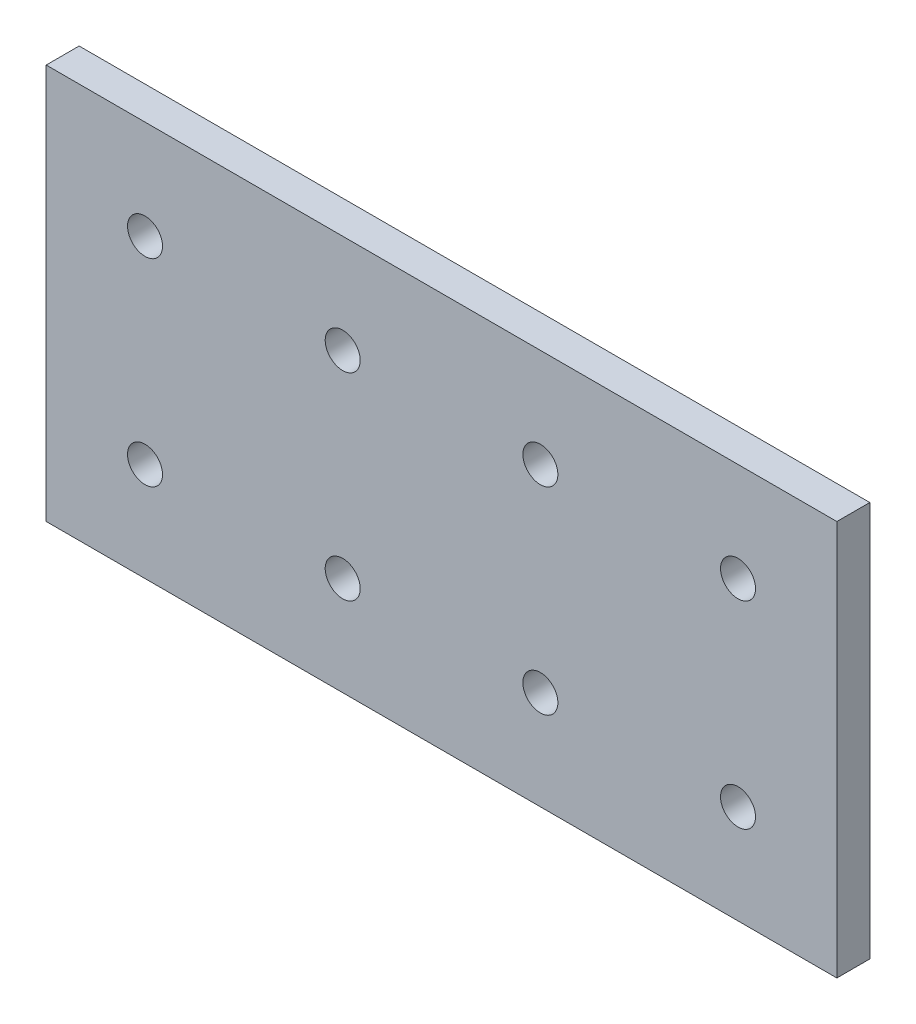
from build123d import *

# Parameters (mm, degrees)
SKETCH1_W                        = 152.4
SKETCH1_H                        = 76.2
BOSS_EXTRUDE1_DEPTH              = 6.35
F_17_64_0_26563_DIAMETER_HOLE1_D = 6.747002
LPATTERN1_COUNT                  = 4
LPATTERN1_PITCH                  = 38.1
LPATTERN1_COUNT_DIR2             = 2
LPATTERN1_PITCH_DIR2             = 38.1


with BuildPart() as part:
    # Sketch1 → Boss-Extrude1 (new body)
    with BuildSketch(Plane.XY):
        with Locations((76.2, 38.1)):
            Rectangle(SKETCH1_W, SKETCH1_H)
    extrude(amount=BOSS_EXTRUDE1_DEPTH)

    # 17/64 (0.26563) Diameter Hole1 (through all)
    with Locations(Plane.XY.offset(6.35)):
        with Locations((19.05, 19.05)):
            f_17_64_0_26563_diameter_hole1 = Hole(F_17_64_0_26563_DIAMETER_HOLE1_D / 2)

    # LPattern1: 17_64 _0.26563_ Diameter Hole1 4 × 2
    with Locations(*[(i * LPATTERN1_PITCH, j * LPATTERN1_PITCH_DIR2, 0) for i in range(LPATTERN1_COUNT) for j in range(LPATTERN1_COUNT_DIR2) if (i, j) != (0, 0)]):
        add(f_17_64_0_26563_diameter_hole1, mode=Mode.SUBTRACT)


solid = part.part
